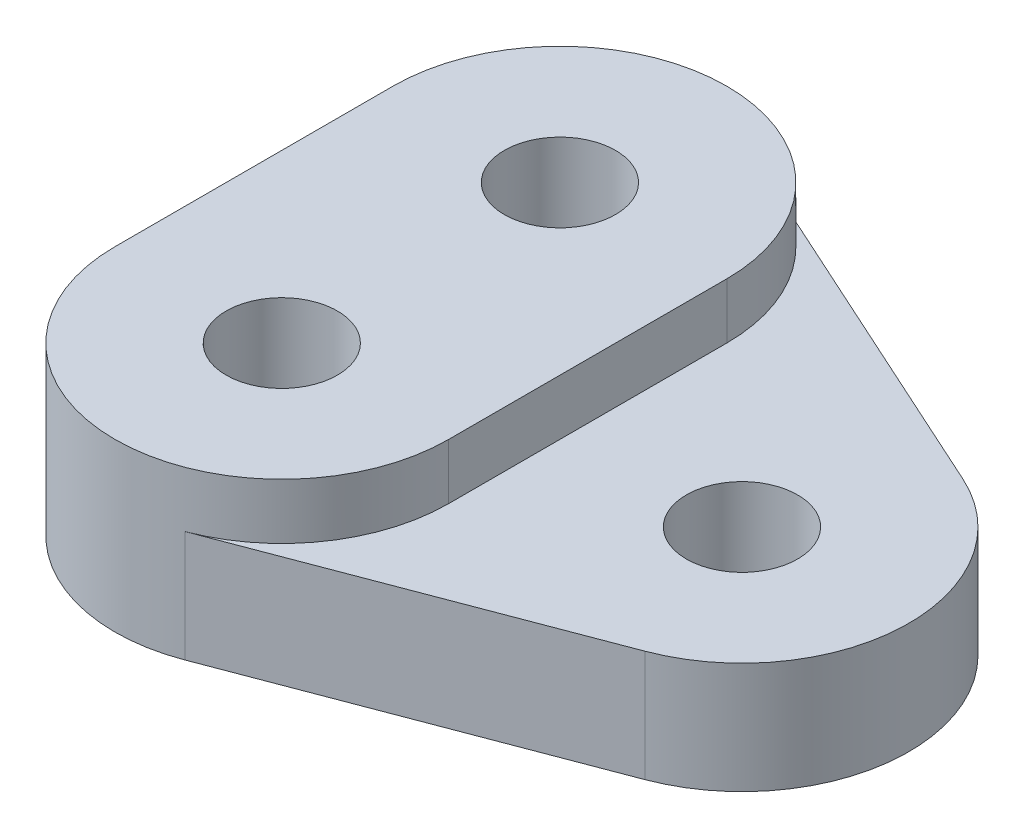
from build123d import *

# Parameters (mm, degrees)
SKETCH1_R           = 2
BOSS_EXTRUDE1_DEPTH = 4
SKETCH2_R           = 2
BOSS_EXTRUDE2_DEPTH = 2


with BuildPart() as part:
    # Sketch1 → Boss-Extrude1 (new body)
    with BuildSketch(Plane(origin=(0, 0, 0), x_dir=(1, 0, 0), z_dir=(0, 1, 0))):
        with BuildLine():
            Line((2.12569774, -5.610829628), (14.125697613, -1.064554922))
            ThreePointArc((14.125697613, -1.064554922), (17.99688746, 4.353037094), (14.482508262, 10.008614247))
            Line((14.482508262, 10.008614247), (2.482508267, 15.46233949))
            ThreePointArc((2.482508267, 15.46233949), (-3.248457357, 15.044553975), (-6, 10))
            Line((-6, 10), (-6, 0))
            ThreePointArc((-6, 0), (-3.409238446, -4.937316398), (2.12569774, -5.610829628))
        make_face()
        with Locations(Location((0, 0, 0), (0, 0, 270))):
            Circle(SKETCH1_R, mode=Mode.SUBTRACT)
        with Locations(Location((0, 10, 0), (0, 0, 270))):
            Circle(SKETCH1_R, mode=Mode.SUBTRACT)
        with Locations(Location((12, 4.546274754, 0), (0, 0, 270))):
            Circle(SKETCH1_R, mode=Mode.SUBTRACT)
    extrude(amount=BOSS_EXTRUDE1_DEPTH)

    # Sketch2 → Boss-Extrude2 (add)
    with BuildSketch(Plane(origin=(0, 4, 0), x_dir=(1, 0, 0), z_dir=(0, 1, 0))):
        with BuildLine():
            ThreePointArc((6, 10), (0, 16), (-6, 10))
            Line((-6, 10), (-6, 0))
            ThreePointArc((-6, 0), (0, -6), (6, 0))
            Line((6, 0), (6, 10))
        make_face()
        Circle(SKETCH2_R, mode=Mode.SUBTRACT)
        with Locations((0, 10)):
            Circle(SKETCH2_R, mode=Mode.SUBTRACT)
    extrude(amount=BOSS_EXTRUDE2_DEPTH)


solid = part.part
